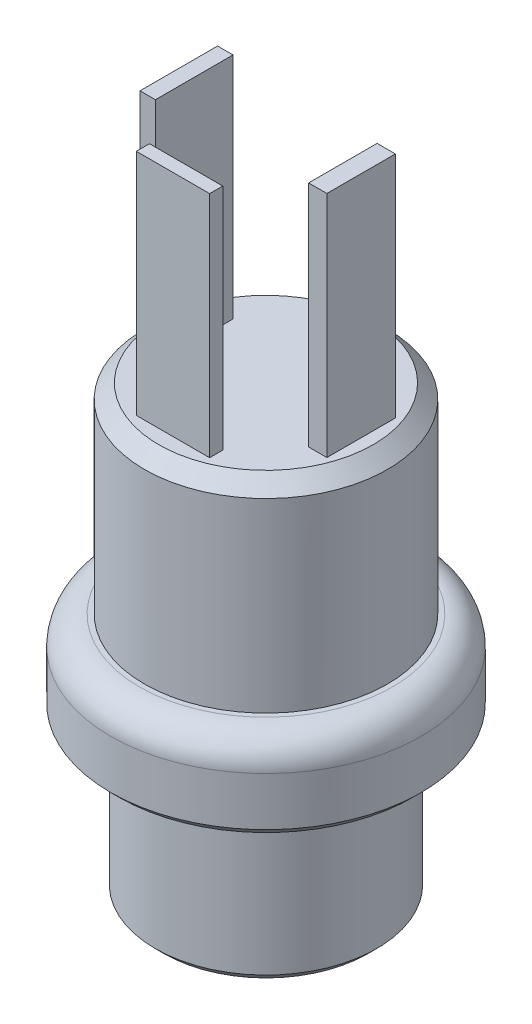
from build123d import *

# Parameters (mm, degrees)
REDONDEO1_R             = 1
REDONDEO2_R             = 1
CHAFL_N1_SIZE           = 0.3
CHAFL_N2_SIZE           = 0.5
CROQUIS2_W              = 2.564908208
CROQUIS2_H              = 0.459088629
CROQUIS2_W_2            = 0.638732005
CROQUIS2_H_2            = 2.39524502
CROQUIS2_W_3            = 0.538930129
CROQUIS2_H_3            = 2.714611022
SALIENTE_EXTRUIR1_DEPTH = 8


with BuildPart() as part:
    # Croquis1 → Revolución1 (revolve)
    with BuildSketch(Plane.XY, mode=Mode.PRIVATE) as revoluci_n1_sk:
        Polygon((0, 0), (1, 0), (1, 6), (2.75, 6), (2.75, -2.5), (3.875, -2.5), (3.875, 3), (5.425, 3), (5.425, 6), (4.25, 6), (4.25, 13), (0, 13), align=None)
    revolve(revoluci_n1_sk.sketch.rotate(Axis((0, 0, 0), (0, -1, 0)), 90), axis=Axis((0, 0, 0), (0, -1, 0)))

    # Redondeo1
    redondeo1_edges = [part.edges().sort_by_distance(p)[0] for p in [
        (0, 0, -1),
    ]]
    fillet(redondeo1_edges, radius=REDONDEO1_R)

    # Redondeo2
    redondeo2_edges = [part.edges().sort_by_distance(p)[0] for p in [
        (0, 6, -5.425),
    ]]
    fillet(redondeo2_edges, radius=REDONDEO2_R)

    # Chaflán1
    chafl_n1_edges = [part.edges().sort_by_distance(p)[0] for p in [
        (0, 3, -5.425),
        (0, -2.5, -3.875),
        (0, -2.5, -2.75),
    ]]
    chamfer(chafl_n1_edges, length=CHAFL_N1_SIZE)

    # Chaflán2
    chafl_n2_edges = [part.edges().sort_by_distance(p)[0] for p in [
        (0, 13, -4.25),
    ]]
    chamfer(chafl_n2_edges, length=CHAFL_N2_SIZE)

    # Croquis2 → Saliente-Extruir1 (add)
    with BuildSketch(Plane(origin=(0, 13, 0), x_dir=(1, 0, 0), z_dir=(0, 1, 0))):
        with Locations((0, -3.023996838)):
            Rectangle(CROQUIS2_W, CROQUIS2_H)
        with Locations((3.009026556, 0)):
            Rectangle(CROQUIS2_W_2, CROQUIS2_H_2)
        with Locations((-2.779482242, 0)):
            Rectangle(CROQUIS2_W_3, CROQUIS2_H_3)
    extrude(amount=SALIENTE_EXTRUIR1_DEPTH)


solid = part.part
